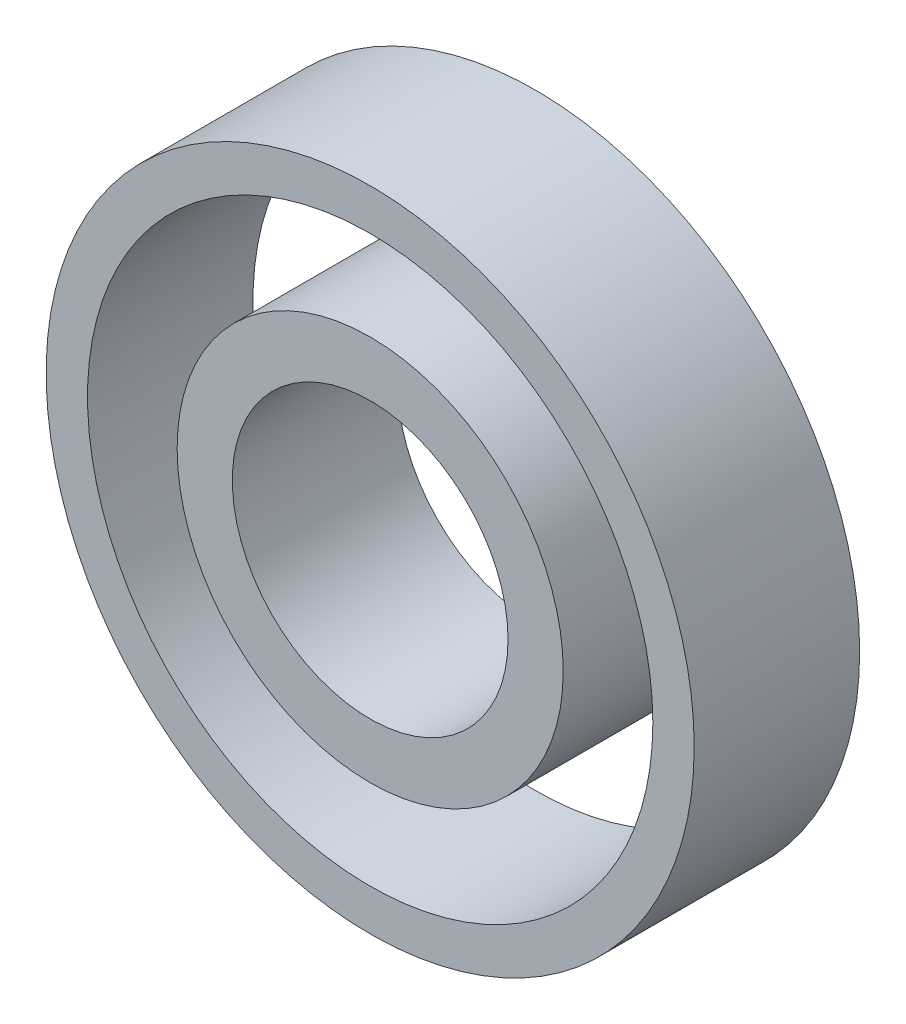
from build123d import *

# Parameters (mm, degrees)
SKETCH1_R           = 23.5
SKETCH1_R_2         = 20.5
BOSS_EXTRUDE1_DEPTH = 12
SKETCH2_R           = 14
SKETCH2_R_2         = 10
BOSS_EXTRUDE2_DEPTH = 12


with BuildPart() as part:
    # Sketch1 → Boss-Extrude1 (new body)
    with BuildSketch(Plane.XY):
        Circle(SKETCH1_R)
        Circle(SKETCH1_R_2, mode=Mode.SUBTRACT)
    extrude(amount=BOSS_EXTRUDE1_DEPTH)


with BuildPart() as body_2:
    # Sketch2 → Boss-Extrude2 (new body)
    with BuildSketch(Plane.XY.offset(12)):
        Circle(SKETCH2_R)
        Circle(SKETCH2_R_2, mode=Mode.SUBTRACT)
    extrude(amount=-BOSS_EXTRUDE2_DEPTH)


solid = Compound([part.part, body_2.part])
